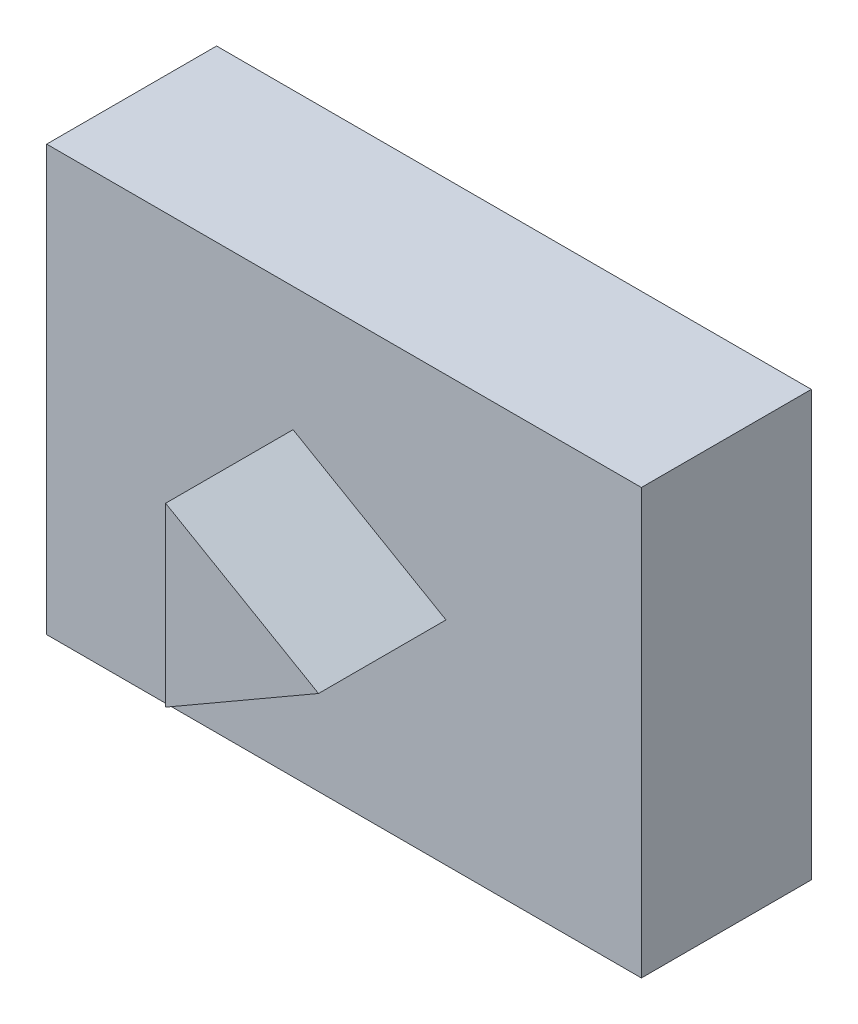
from build123d import *

# Parameters (mm, degrees)
SKETCH_1_W      = 70
SKETCH_1_H      = 50
EXTRUDE_1_DEPTH = 10
EXTRUDE_2_DEPTH = 15


with BuildPart() as part:
    # 草图1 → 凸台-拉伸1 (new, symmetric)
    with BuildSketch(Plane.XY):
        Rectangle(SKETCH_1_W, SKETCH_1_H)
    extrude(amount=EXTRUDE_1_DEPTH, both=True)

    # 草图2 → 凸台-拉伸2 (add)
    with BuildSketch(Plane.XY.offset(10)):
        Polygon((12, 0), (-6, 10.392304845), (-6, -10.392304845), align=None)
    extrude(amount=EXTRUDE_2_DEPTH)


solid = part.part
